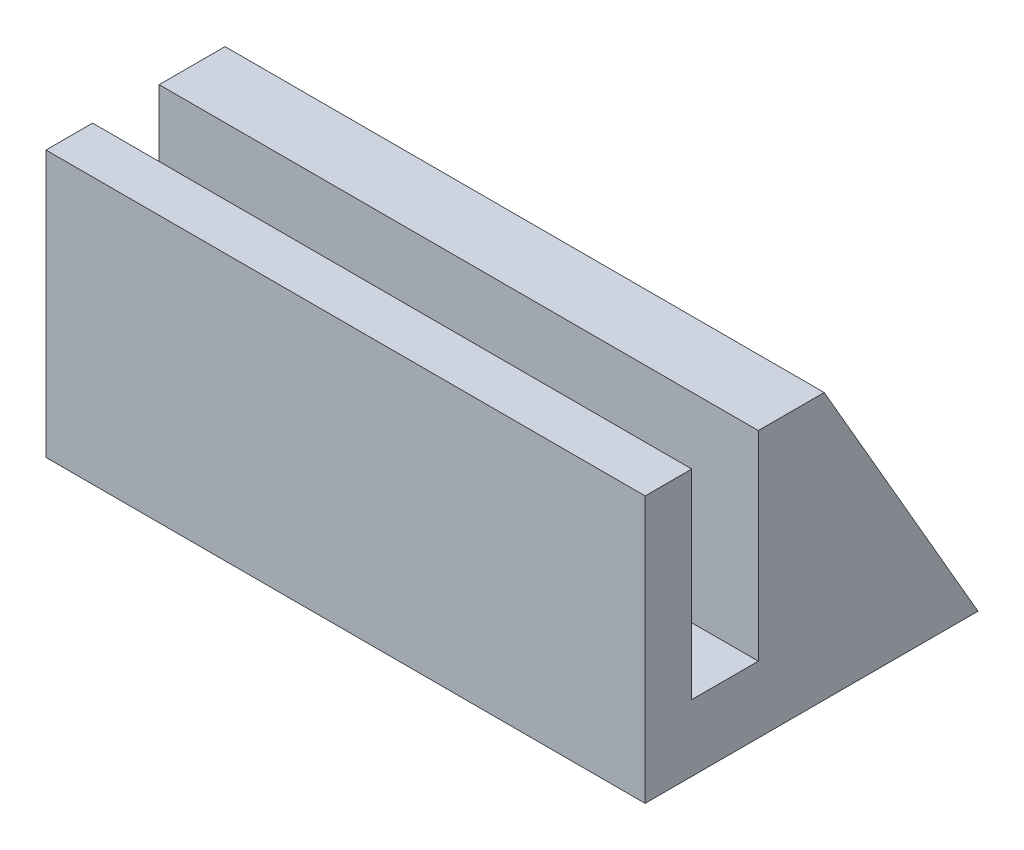
from build123d import *

# Parameters (mm, degrees)
SKETCH2_W           = 45
SKETCH2_H           = 20
BOSS_EXTRUDE1_DEPTH = 25
SKETCH5_W           = 45
SKETCH5_H           = 5
CUT_EXTRUDE1_DEPTH  = 15
CUT_EXTRUDE2_DEPTH  = 45
SKETCH8_W           = 38.3
SKETCH8_H           = 9.6
CUT_EXTRUDE3_DEPTH  = 10


with BuildPart() as part:
    # Sketch2 → Boss-Extrude1 (new body)
    with BuildSketch(Plane.XY):
        Rectangle(SKETCH2_W, SKETCH2_H)
    extrude(amount=BOSS_EXTRUDE1_DEPTH)

    # Sketch5 → Cut-Extrude1 (cut)
    with BuildSketch(Plane(origin=(0, 10, 0), x_dir=(1, 0, 0), z_dir=(0, 1, 0))):
        with Locations((0, -19)):
            Rectangle(SKETCH5_W, SKETCH5_H)
    extrude(amount=-CUT_EXTRUDE1_DEPTH, mode=Mode.SUBTRACT)

    # Sketch7 → Cut-Extrude2 (cut)
    with BuildSketch(Plane(origin=(22.5, 0, 0), x_dir=(0, 0, -1), z_dir=(1, 0, 0))):
        Polygon((0, -10), (0, 10), (-11.55, 10), align=None)
    extrude(amount=-CUT_EXTRUDE2_DEPTH, mode=Mode.SUBTRACT)

    # Sketch8 → Cut-Extrude3 (cut)
    with BuildSketch(Plane(origin=(0, -2.50097253, 4.330688364), x_dir=(-1, 0, 0), z_dir=(0, 0.5000972435561909, -0.8659692529111528))):
        Rectangle(SKETCH8_W, SKETCH8_H)
    extrude(amount=-CUT_EXTRUDE3_DEPTH, mode=Mode.SUBTRACT)


solid = part.part
